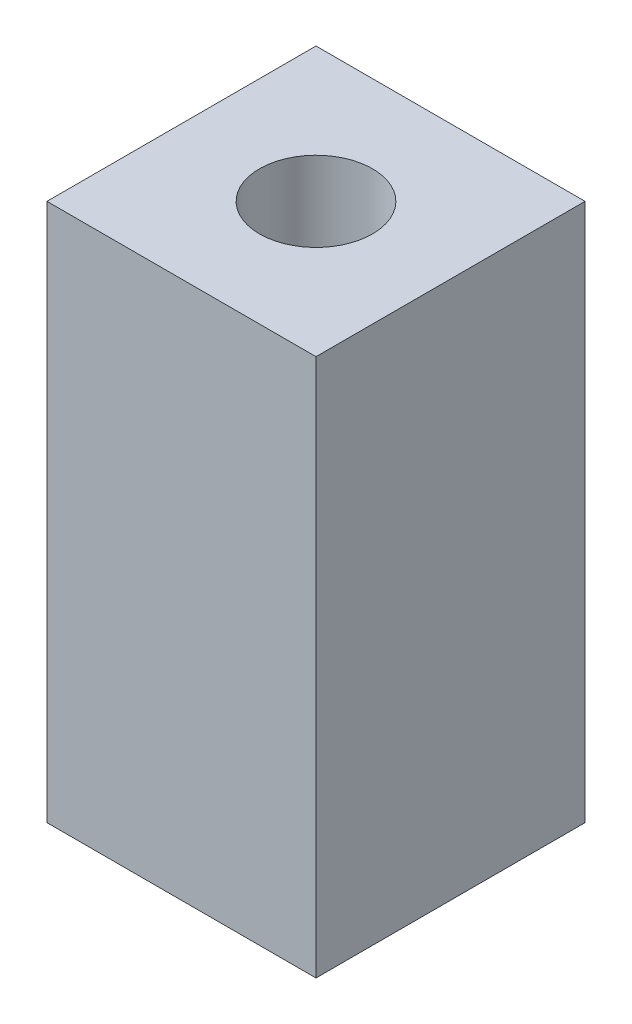
from build123d import *

# Parameters (mm, degrees)
SKETCH1_W           = 5
SKETCH1_H           = 5
BOSS_EXTRUDE1_DEPTH = 5
SKETCH2_R           = 1.05
CUT_EXTRUDE1_DEPTH  = 3
CUT_EXTRUDE2_START  = -3
SKETCH3_R           = 1.05
CUT_EXTRUDE2_DEPTH  = 3


with BuildPart() as part:
    # Sketch1 → Boss-Extrude1 (new, symmetric)
    with BuildSketch(Plane(origin=(0, 0, 0), x_dir=(1, 0, 0), z_dir=(0, 1, 0))):
        Rectangle(SKETCH1_W, SKETCH1_H)
    extrude(amount=BOSS_EXTRUDE1_DEPTH, both=True)

    # Sketch2 → Cut-Extrude1 (cut)
    with BuildSketch(Plane(origin=(0, 5, 0), x_dir=(1, 0, 0), z_dir=(0, 1, 0))):
        with Locations(Location((0, 0, 0), (0, 0, 270))):
            Circle(SKETCH2_R)
    extrude(amount=-CUT_EXTRUDE1_DEPTH, mode=Mode.SUBTRACT)

    # Sketch3 → Cut-Extrude2 (cut)
    with BuildSketch(Plane.XZ.offset(5).offset(CUT_EXTRUDE2_START)):
        with Locations(Location((0, 0, 0), (0, 0, 90))):
            Circle(SKETCH3_R)
    extrude(amount=CUT_EXTRUDE2_DEPTH, mode=Mode.SUBTRACT)


solid = part.part
